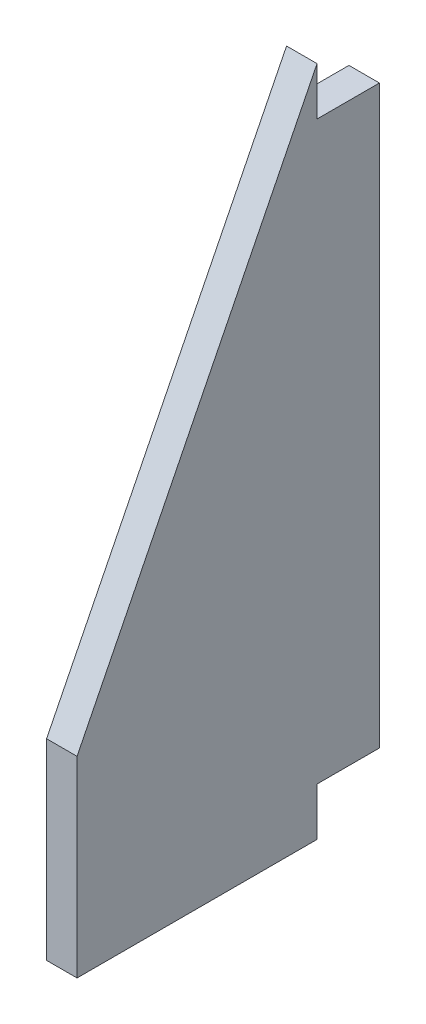
from build123d import *

# Parameters (mm, degrees)
BOSS_EXTRUDE1_DEPTH = 3.175


with BuildPart() as part:
    # Sketch1 → Boss-Extrude1 (new, symmetric)
    with BuildSketch(Plane(origin=(0, 0, 0), x_dir=(0, 0, -1), z_dir=(1, 0, 0))):
        Polygon((-34, 0), (-84, 0), (-84, 40), (-34, 140), (-34, 130), (-21, 130), (-21, 10), (-34, 10), align=None)
    extrude(amount=BOSS_EXTRUDE1_DEPTH, both=True)


solid = part.part
